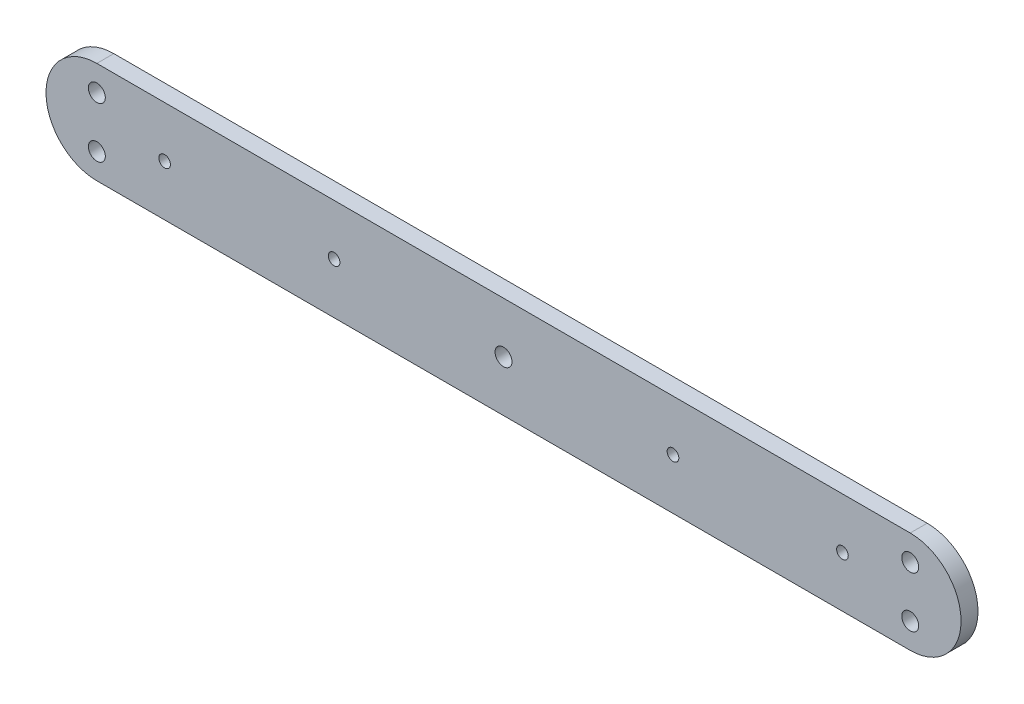
from build123d import *

# Parameters (mm, degrees)
SKETCH1_R           = 3.175
SKETCH1_R_2         = 2.1828125
BOSS_EXTRUDE1_DEPTH = 6.35


with BuildPart() as part:
    # Sketch1 → Boss-Extrude1 (new body)
    with BuildSketch(Plane.XY):
        with BuildLine():
            Line((-89.243243243, 19.05), (215.556756757, 19.05))
            ThreePointArc((215.556756757, 19.05), (234.606756757, 0), (215.556756757, -19.05))
            Line((215.556756757, -19.05), (-89.243243243, -19.05))
            ThreePointArc((-89.243243243, -19.05), (-108.293243243, 0), (-89.243243243, 19.05))
        make_face()
        with Locations((63.156756757, 0)):
            Circle(SKETCH1_R, mode=Mode.SUBTRACT)
        with Locations((-0.343243243, 0)):
            Circle(SKETCH1_R_2, mode=Mode.SUBTRACT)
        with Locations((126.656756757, 0)):
            Circle(SKETCH1_R_2, mode=Mode.SUBTRACT)
        with Locations((215.556756757, -9.525)):
            Circle(SKETCH1_R, mode=Mode.SUBTRACT)
        with Locations((215.556756757, 9.525)):
            Circle(SKETCH1_R, mode=Mode.SUBTRACT)
        with Locations((-89.243243243, 9.525)):
            Circle(SKETCH1_R, mode=Mode.SUBTRACT)
        with Locations((-89.243243243, -9.525)):
            Circle(SKETCH1_R, mode=Mode.SUBTRACT)
        with Locations((-63.843243243, 0)):
            Circle(SKETCH1_R_2, mode=Mode.SUBTRACT)
        with Locations((190.156756757, 0)):
            Circle(SKETCH1_R_2, mode=Mode.SUBTRACT)
    extrude(amount=BOSS_EXTRUDE1_DEPTH)


solid = part.part
